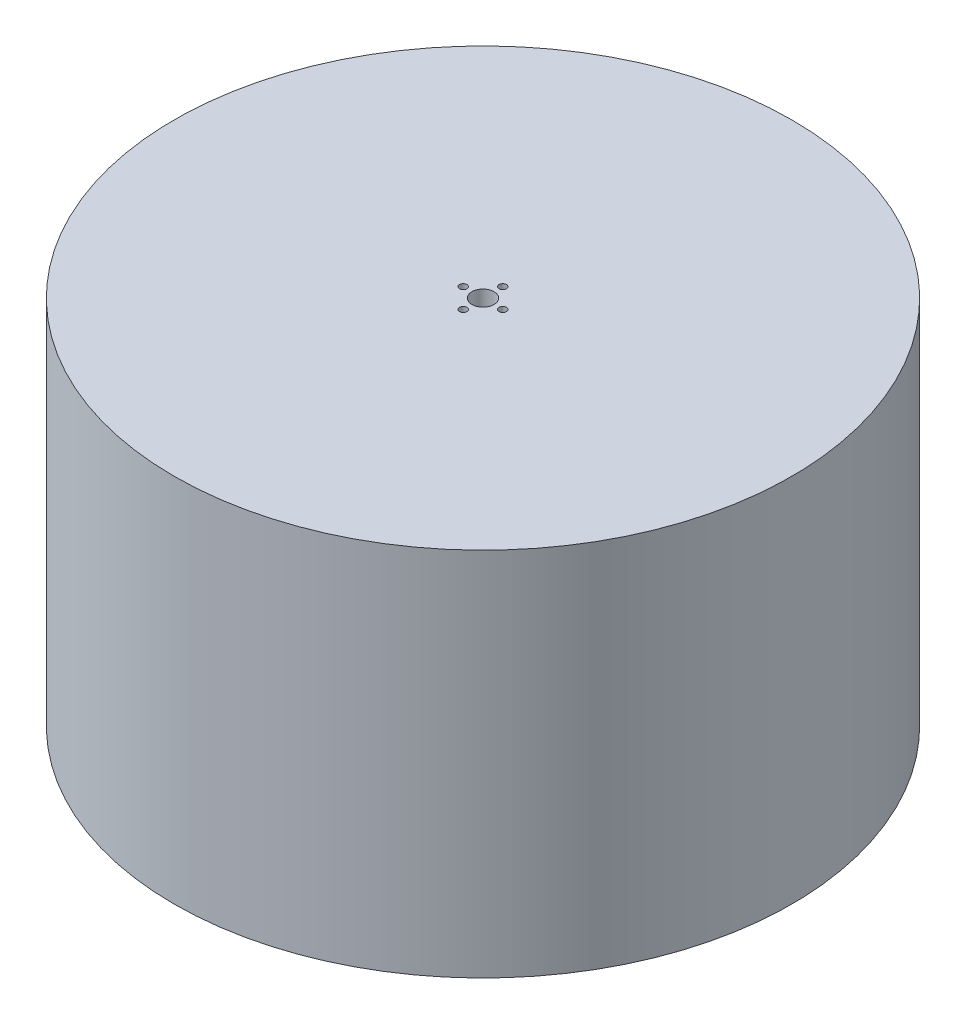
from build123d import *

# Parameters (mm, degrees)
SKETCH1_R           = 125
BOSS_EXTRUDE1_DEPTH = 150
SKETCH2_R           = 121
CUT_EXTRUDE1_DEPTH  = 140
SKETCH3_R           = 1.5
SKETCH3_R_2         = 4.5
CUT_EXTRUDE2_DEPTH  = 232.840462387


with BuildPart() as part:
    # Sketch1 → Boss-Extrude1 (new body)
    with BuildSketch(Plane(origin=(0, 0, 0), x_dir=(1, 0, 0), z_dir=(0, 1, 0))):
        with Locations(Location((0, 0, 0), (0, 0, 270))):
            Circle(SKETCH1_R)
    extrude(amount=BOSS_EXTRUDE1_DEPTH)

    # Sketch2 → Cut-Extrude1 (cut)
    with BuildSketch(Plane.XZ):
        with Locations(Location((0, 0, 0), (0, 0, 270))):
            Circle(SKETCH2_R)
    extrude(amount=-CUT_EXTRUDE1_DEPTH, mode=Mode.SUBTRACT)

    # Sketch3 → Cut-Extrude2 (cut, through all)
    with BuildSketch(Plane(origin=(0, 150, 0), x_dir=(1, 0, 0), z_dir=(0, 1, 0))):
        with Locations(Location((-8, 0, 0), (0, 0, 270))):
            Circle(SKETCH3_R)
        with Locations(Location((0, 0, 0), (0, 0, 270))):
            Circle(SKETCH3_R_2)
        with Locations(Location((0, 8, 0), (0, 0, 270))):
            Circle(SKETCH3_R)
        with Locations(Location((8, 0, 0), (0, 0, 270))):
            Circle(SKETCH3_R)
        with Locations(Location((0, -8, 0), (0, 0, 270))):
            Circle(SKETCH3_R)
    extrude(amount=-CUT_EXTRUDE2_DEPTH, mode=Mode.SUBTRACT)


solid = part.part
